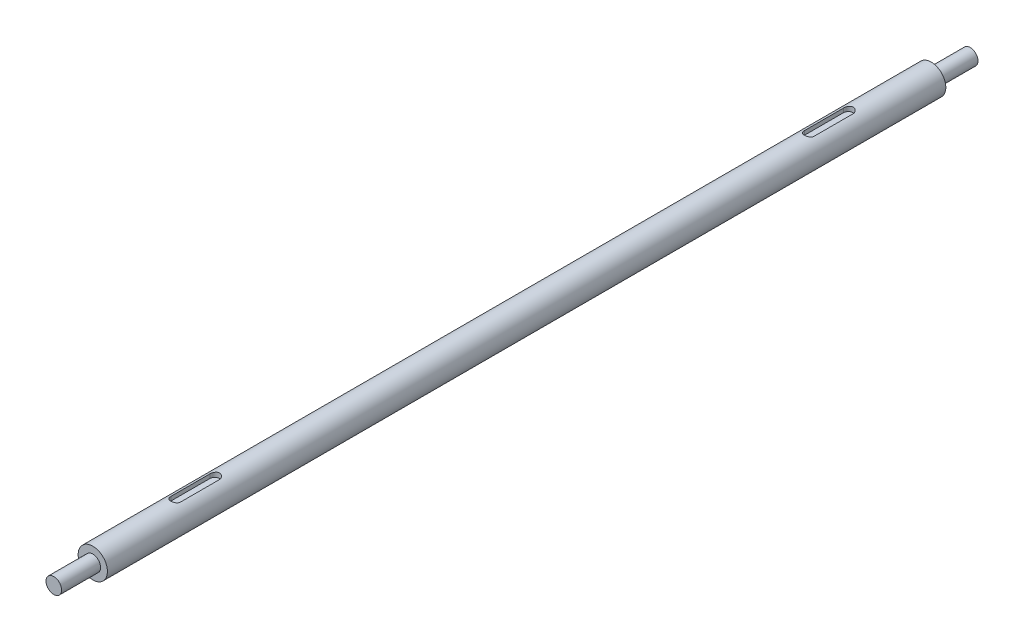
from build123d import *

# Parameters (mm, degrees)
SKETCH_1_R          = 7.5
EXTRUDE_1_DEPTH     = 215
CUT_EXTRUDE_1_DEPTH = 2.5
SKETCH_3_R          = 4
EXTRUDE_2_DEPTH     = 20


with BuildPart() as part:
    # 草图1 → 凸台-拉伸1 (new, symmetric)
    with BuildSketch(Plane.XY):
        Circle(SKETCH_1_R)
    extrude(amount=EXTRUDE_1_DEPTH, both=True)

    # 草图2 → 切除-拉伸1 (cut)
    with BuildSketch(Plane(origin=(0, 7.5, 0), x_dir=(1, 0, 0), z_dir=(0, 1, 0))):
        with BuildLine():
            Line((2.5, -152.5), (2.5, -172.5))
            ThreePointArc((2.5, -172.5), (0, -175), (-2.5, -172.5))
            Line((-2.5, -172.5), (-2.5, -152.5))
            ThreePointArc((-2.5, -152.5), (0, -150), (2.5, -152.5))
        make_face()
        with BuildLine():
            Line((2.5, 152.5), (2.5, 172.5))
            ThreePointArc((2.5, 172.5), (0, 175), (-2.5, 172.5))
            Line((-2.5, 172.5), (-2.5, 152.5))
            ThreePointArc((-2.5, 152.5), (0, 150), (2.5, 152.5))
        make_face()
    extrude(amount=-CUT_EXTRUDE_1_DEPTH, mode=Mode.SUBTRACT)

    # 草图3 → 凸台-拉伸2 (add)
    with BuildSketch(Plane.XY.offset(215)):
        Circle(SKETCH_3_R)
    extrude_2 = extrude(amount=EXTRUDE_2_DEPTH)

    # 镜向1: 凸台-拉伸2 across plane
    add(extrude_2.mirror(Plane.XY))


solid = part.part
